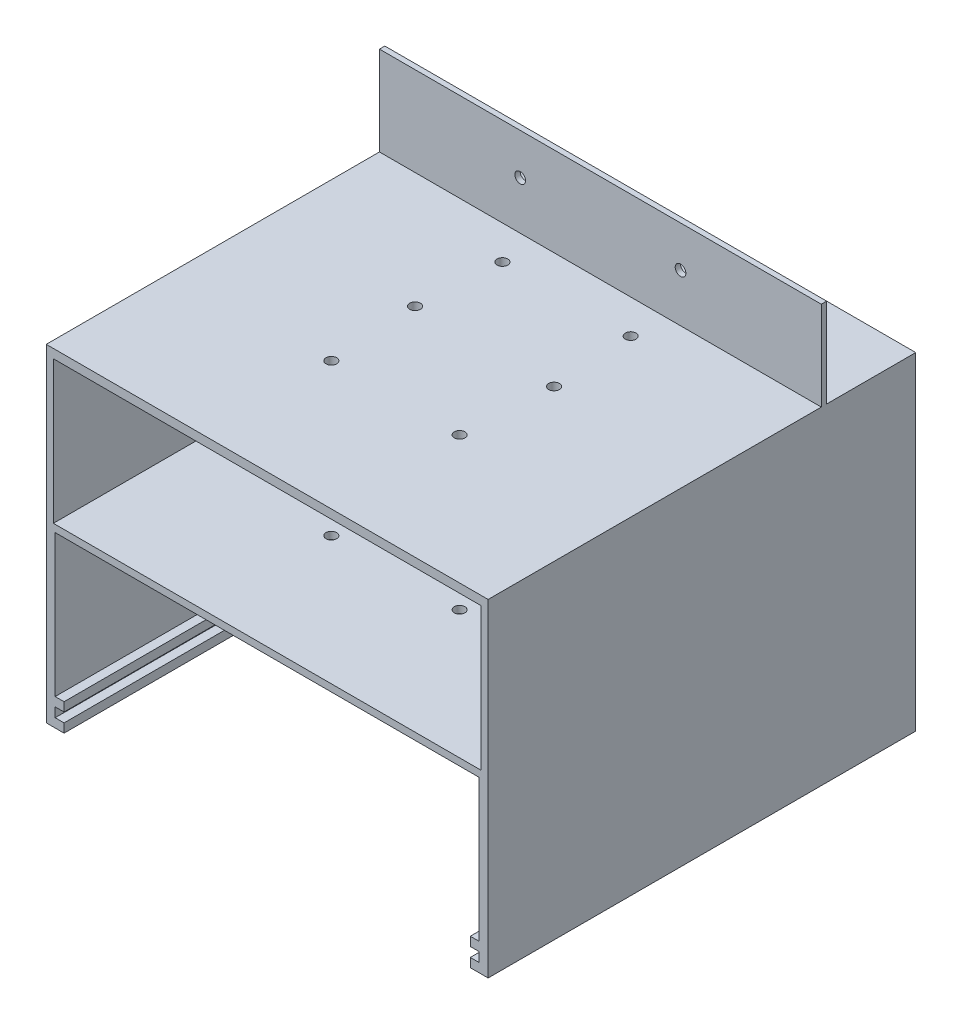
from build123d import *

# Parameters (mm, degrees)
SKETCH_2_W          = 124
SKETCH_2_H          = 120
EXTRUDE_1_DEPTH     = 2
SKETCH_3_W          = 2
SKETCH_3_H          = 120
EXTRUDE_2_DEPTH     = 40
SKETCH_4_W          = 120
SKETCH_4_H          = 2
EXTRUDE_3_DEPTH     = 5
SKETCH_6_W          = 124
SKETCH_6_H          = 120
EXTRUDE_4_DEPTH     = 2.5
SKETCH_9_W          = 124
SKETCH_9_H          = 1.5
EXTRUDE_5_DEPTH     = 25
SKETCH_10_R         = 1.5
CUT_EXTRUDE_2_DEPTH = 1.5
SKETCH_11_R         = 1.5
CUT_EXTRUDE_3_DEPTH = 51
SKETCH_12_W         = 2.5
SKETCH_12_H         = 120
EXTRUDE_6_DEPTH     = 47.5
SKETCH_14_W         = 2.5
SKETCH_14_H         = 2.5
EXTRUDE_8_DEPTH     = 120
SKETCH_15_W         = 119
SKETCH_15_H         = 3
EXTRUDE_9_DEPTH     = 47.5
SKETCH_16_R         = 2.5
CUT_EXTRUDE_4_DEPTH = 10
SKETCH_18_W         = 2.5
SKETCH_18_H         = 2.5
EXTRUDE_10_DEPTH    = 120


with BuildPart() as part:
    # 草图2 → 凸台-拉伸1 (new body)
    with BuildSketch(Plane(origin=(0, 0, 0), x_dir=(1, 0, 0), z_dir=(0, 1, 0))):
        Rectangle(SKETCH_2_W, SKETCH_2_H)
    extrude(amount=EXTRUDE_1_DEPTH)

    # 草图3 → 凸台-拉伸2 (add)
    with BuildSketch(Plane(origin=(0, 2, 0), x_dir=(1, 0, 0), z_dir=(0, 1, 0))):
        with Locations((-61, 0)):
            Rectangle(SKETCH_3_W, SKETCH_3_H)
        with Locations((61, 0)):
            Rectangle(SKETCH_3_W, SKETCH_3_H)
    extrude(amount=EXTRUDE_2_DEPTH)

    # 草图4 → 凸台-拉伸3 (add)
    with BuildSketch(Plane(origin=(0, 2, 0), x_dir=(1, 0, 0), z_dir=(0, 1, 0))):
        with Locations((0, 59)):
            Rectangle(SKETCH_4_W, SKETCH_4_H)
    extrude(amount=EXTRUDE_3_DEPTH)

    # 草图6 → 凸台-拉伸4 (add)
    with BuildSketch(Plane(origin=(0, 42, 0), x_dir=(1, 0, 0), z_dir=(0, 1, 0))):
        Rectangle(SKETCH_6_W, SKETCH_6_H)
    extrude(amount=EXTRUDE_4_DEPTH)

    # 草图9 → 凸台-拉伸5 (add)
    with BuildSketch(Plane(origin=(0, 44.5, 0), x_dir=(1, 0, 0), z_dir=(0, 1, 0))):
        with Locations((0, 34.25)):
            Rectangle(SKETCH_9_W, SKETCH_9_H)
    extrude(amount=EXTRUDE_5_DEPTH)

    # 草图10 → 切除-拉伸2 (cut)
    with BuildSketch(Plane(origin=(0, 0, -35), x_dir=(-1, 0, 0), z_dir=(0, 0, -1))):
        with Locations((-22.5, 58)):
            Circle(SKETCH_10_R)
        with Locations((22.5, 58)):
            Circle(SKETCH_10_R)
    extrude(amount=-CUT_EXTRUDE_2_DEPTH, mode=Mode.SUBTRACT)

    # 草图11 → 切除-拉伸3 (cut)
    with BuildSketch(Plane(origin=(0, 44.5, 0), x_dir=(1, 0, 0), z_dir=(0, 1, 0))):
        with Locations(Location((-19.5, 1, 0), (0, 0, 270))):
            Circle(SKETCH_11_R)
        with Locations(Location((-18, 24, 0), (0, 0, 270))):
            Circle(SKETCH_11_R)
        with Locations(Location((-18, -24, 0), (0, 0, 270))):
            Circle(SKETCH_11_R)
        with Locations(Location((18, -24, 0), (0, 0, 270))):
            Circle(SKETCH_11_R)
        with Locations(Location((19.5, 1, 0), (0, 0, 270))):
            Circle(SKETCH_11_R)
        with Locations(Location((18, 24, 0), (0, 0, 270))):
            Circle(SKETCH_11_R)
    extrude(amount=-CUT_EXTRUDE_3_DEPTH, mode=Mode.SUBTRACT)

    # 草图12 → 凸台-拉伸6 (add)
    with BuildSketch(Plane.XZ):
        with Locations((-60.75, 0)):
            Rectangle(SKETCH_12_W, SKETCH_12_H)
        with Locations((60.75, 0)):
            Rectangle(SKETCH_12_W, SKETCH_12_H)
    extrude(amount=EXTRUDE_6_DEPTH)

    # 草图14 → 凸台-拉伸8 (add)
    with BuildSketch(Plane(origin=(0, 0, -60), x_dir=(-1, 0, 0), z_dir=(0, 0, -1))):
        with Locations((-58.25, -46.25)):
            Rectangle(SKETCH_14_W, SKETCH_14_H)
        with Locations((58.25, -46.25)):
            Rectangle(SKETCH_14_W, SKETCH_14_H)
    extrude(amount=-EXTRUDE_8_DEPTH)

    # 草图15 → 凸台-拉伸9 (add)
    with BuildSketch(Plane.XZ):
        with Locations((0, -58.5)):
            Rectangle(SKETCH_15_W, SKETCH_15_H)
    extrude(amount=EXTRUDE_9_DEPTH)

    # 草图16 → 切除-拉伸4 (cut)
    with BuildSketch(Plane.ZY.offset(62)):
        with Locations((2.778789214, 31.36631919)):
            Circle(SKETCH_16_R)
        with Locations((2.778789214, -33.63368081)):
            Circle(SKETCH_16_R)
    extrude(amount=-CUT_EXTRUDE_4_DEPTH, mode=Mode.SUBTRACT)

    # 草图18 → 凸台-拉伸10 (add)
    with BuildSketch(Plane.XY.offset(60)):
        with Locations((-58.25, -41.1)):
            Rectangle(SKETCH_18_W, SKETCH_18_H)
        with Locations((58.25, -41.1)):
            Rectangle(SKETCH_18_W, SKETCH_18_H)
    extrude(amount=-EXTRUDE_10_DEPTH)


solid = part.part
